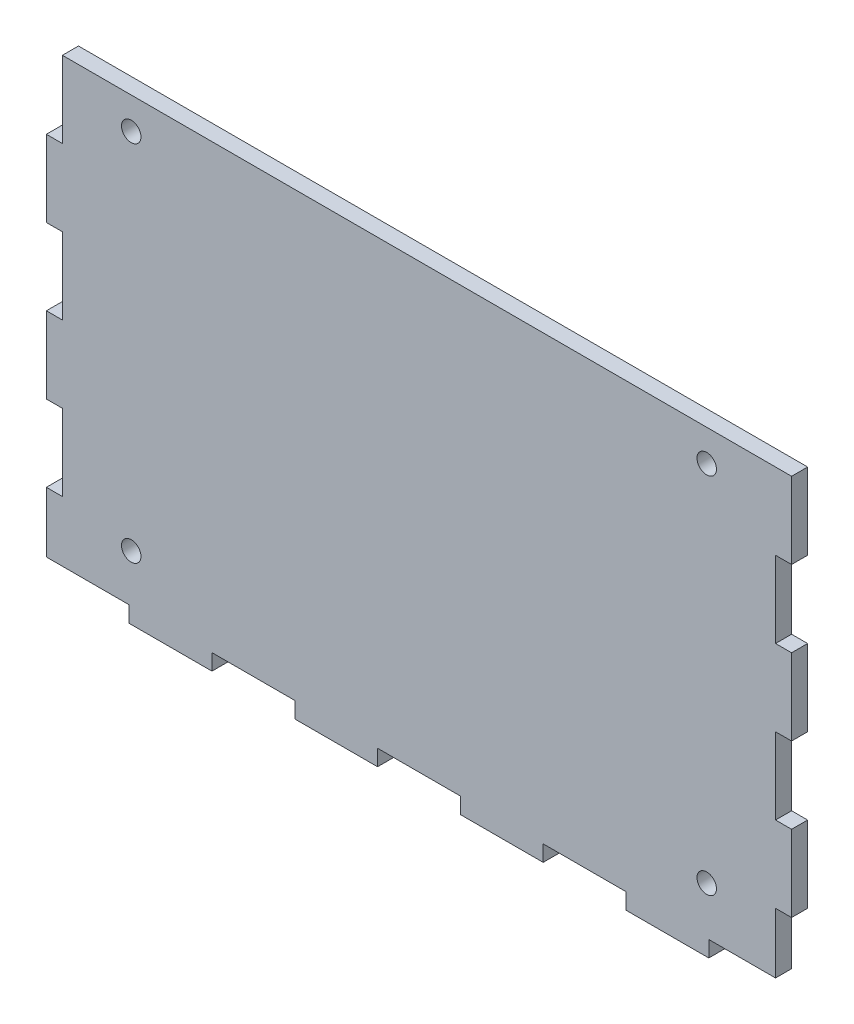
from build123d import *

# Parameters (mm, degrees)
SKETCH1_W           = 130
SKETCH1_H           = 80
BOSS_EXTRUDE1_DEPTH = 2.8
SKETCH2_W           = 14.444444444
SKETCH2_H           = 2.8
SKETCH2_W_2         = 2.8
SKETCH2_H_2         = 13.333333334
SKETCH2_H_3         = 13.333333333
CUT_EXTRUDE1_DEPTH  = 153.669053839
CUT_EXTRUDE2_REACH  = 154.669
SKETCH3_R           = 1.7


with BuildPart() as part:
    # Sketch1 → Boss-Extrude1 (new body)
    with BuildSketch(Plane.XY):
        with Locations((65, 40)):
            Rectangle(SKETCH1_W, SKETCH1_H)
    extrude(amount=BOSS_EXTRUDE1_DEPTH)

    # Sketch2 → Cut-Extrude1 (cut, through all)
    with BuildSketch(Plane.XY.offset(2.8)):
        with Locations((7.222222222, 1.4)):
            Rectangle(SKETCH2_W, SKETCH2_H)
        with Locations((36.111111111, 1.4)):
            Rectangle(SKETCH2_W, SKETCH2_H)
        with Locations((65, 1.4)):
            Rectangle(SKETCH2_W, SKETCH2_H)
        with Locations((93.888888889, 1.4)):
            Rectangle(SKETCH2_W, SKETCH2_H)
        Polygon((115.555555556, 0), (115.555555556, 2.8), (127.2, 2.8), (127.2, 13.333333333), (130, 13.333333333), (130, 0), align=None)
        with Locations((1.4, 20)):
            Rectangle(SKETCH2_W_2, SKETCH2_H_2)
        with Locations((1.4, 46.666666667)):
            Rectangle(SKETCH2_W_2, SKETCH2_H_3)
        with Locations((1.4, 73.333333334)):
            Rectangle(SKETCH2_W_2, SKETCH2_H_3)
        with Locations((128.6, 33.333333334)):
            Rectangle(SKETCH2_W_2, SKETCH2_H_3)
        with Locations((128.6, 60)):
            Rectangle(SKETCH2_W_2, SKETCH2_H_2)
    extrude(amount=-CUT_EXTRUDE1_DEPTH, mode=Mode.SUBTRACT)

    # Sketch3 → Cut-Extrude2 (cut, up to next)
    with BuildSketch(Plane.XY.offset(2.8), mode=Mode.PRIVATE) as cut_extrude2_sk1:
        with Locations((14.8, 74.5)):
            Circle(SKETCH3_R)
    cut_extrude2_tool1 = extrude(cut_extrude2_sk1.sketch, amount=-CUT_EXTRUDE2_REACH, mode=Mode.PRIVATE) & part.part
    # Sketch3 → Cut-Extrude2 (cut, up to next)
    with BuildSketch(Plane.XY.offset(2.8), mode=Mode.PRIVATE) as cut_extrude2_sk2:
        with Locations(Location((115.2, 74.5, 0), (0, 0, 180))):
            Circle(SKETCH3_R)
    cut_extrude2_tool2 = extrude(cut_extrude2_sk2.sketch, amount=-CUT_EXTRUDE2_REACH, mode=Mode.PRIVATE) & part.part
    # Sketch3 → Cut-Extrude2 (cut, up to next)
    with BuildSketch(Plane.XY.offset(2.8), mode=Mode.PRIVATE) as cut_extrude2_sk3:
        with Locations((14.8, 11.124824394)):
            Circle(SKETCH3_R)
    cut_extrude2_tool3 = extrude(cut_extrude2_sk3.sketch, amount=-CUT_EXTRUDE2_REACH, mode=Mode.PRIVATE) & part.part
    # Sketch3 → Cut-Extrude2 (cut, up to next)
    with BuildSketch(Plane.XY.offset(2.8), mode=Mode.PRIVATE) as cut_extrude2_sk4:
        with Locations((115.2, 11.124824394)):
            Circle(SKETCH3_R)
    cut_extrude2_tool4 = extrude(cut_extrude2_sk4.sketch, amount=-CUT_EXTRUDE2_REACH, mode=Mode.PRIVATE) & part.part
    add(cut_extrude2_tool1.solids().sort_by_distance((14.8, 74.5, 2.8))[0], mode=Mode.SUBTRACT)
    add(cut_extrude2_tool2.solids().sort_by_distance((115.2, 74.5, 2.8))[0], mode=Mode.SUBTRACT)
    add(cut_extrude2_tool3.solids().sort_by_distance((14.8, 11.124824, 2.8))[0], mode=Mode.SUBTRACT)
    add(cut_extrude2_tool4.solids().sort_by_distance((115.2, 11.124824, 2.8))[0], mode=Mode.SUBTRACT)


solid = part.part
